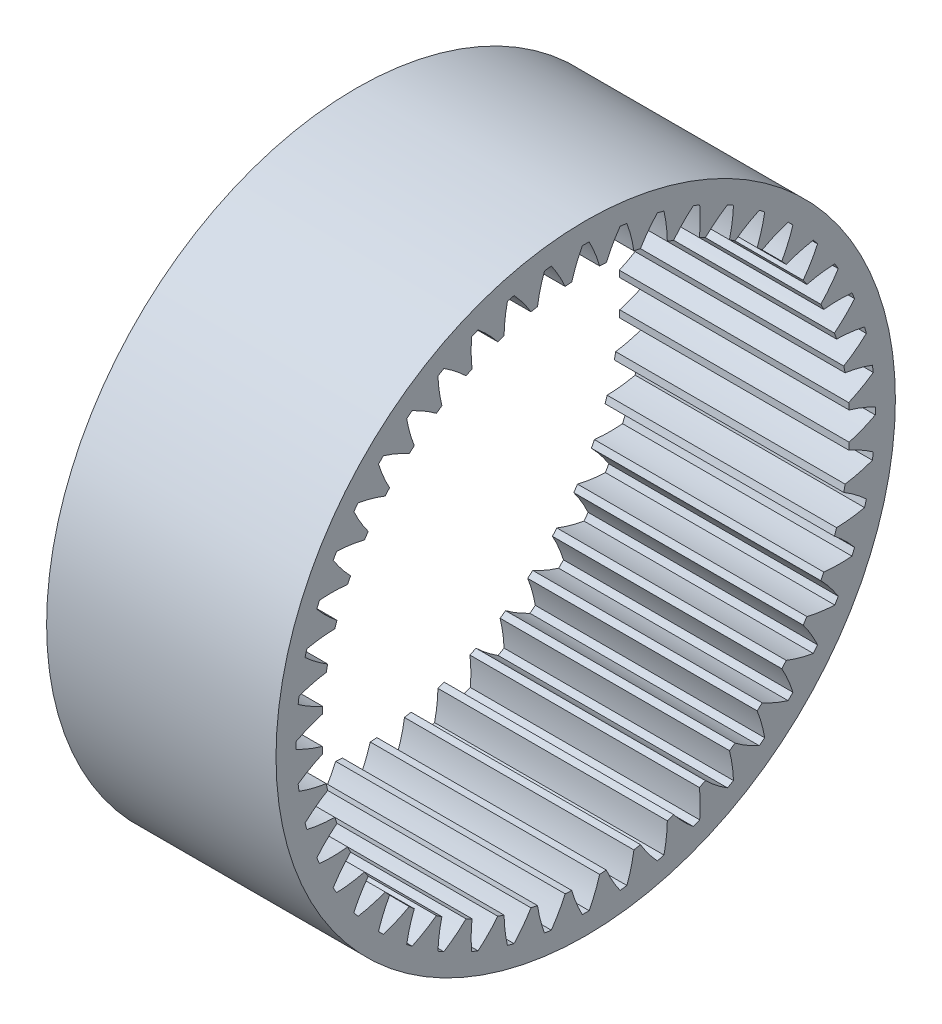
from build123d import *

# Parameters (mm, degrees)
BASPROSKE_W     = 50
BASPROSKE_H     = 10
TOOTHCUT_DEPTH  = 108.761310311
TEETHCUTS_COUNT = 48
TEETHCUTS_ANGLE = 352.5


with BuildPart() as part:
    # BasProSke → Base-Revolve (revolve)
    with BuildSketch(Plane(origin=(0, 0, 0), x_dir=(1, 0, 0), z_dir=(0, 1, 0)), mode=Mode.PRIVATE) as base_revolve_sk:
        with Locations((25, 62.5)):
            Rectangle(BASPROSKE_W, BASPROSKE_H)
    revolve(base_revolve_sk.sketch.rotate(Axis((-10, 0, 0), (1, 0, 0)), 180), axis=Axis((-10, 0, 0), (1, 0, 0)))

    # TooCutSke → ToothCut (cut, through all)
    with BuildSketch(Plane(origin=(0, 0, 0), x_dir=(0, 0, -1), z_dir=(1, 0, 0))):
        with BuildLine():
            ThreePointArc((3.039998108, 57.394146537), (2.040403675, 60.317014763), (0.74554281, 63.12159727))
            ThreePointArc((0.74554281, 63.12159727), (0, 63.126), (-0.74554281, 63.12159727))
            ThreePointArc((-0.74554281, 63.12159727), (-2.040403675, 60.317014763), (-3.039998108, 57.394146537))
            ThreePointArc((-3.039998108, 57.394146537), (0, 57.4746), (3.039998108, 57.394146537))
        make_face()
    toothcut = extrude(amount=TOOTHCUT_DEPTH, mode=Mode.SUBTRACT)

    # TeethCuts: ToothCut ×48 about axis
    teethcuts_axis = Axis((-10, 0, 0), (1, 0, 0))
    for i in range(1, TEETHCUTS_COUNT):
        add(toothcut.rotate(teethcuts_axis, i * TEETHCUTS_ANGLE / (TEETHCUTS_COUNT - 1)), mode=Mode.SUBTRACT)


solid = part.part
